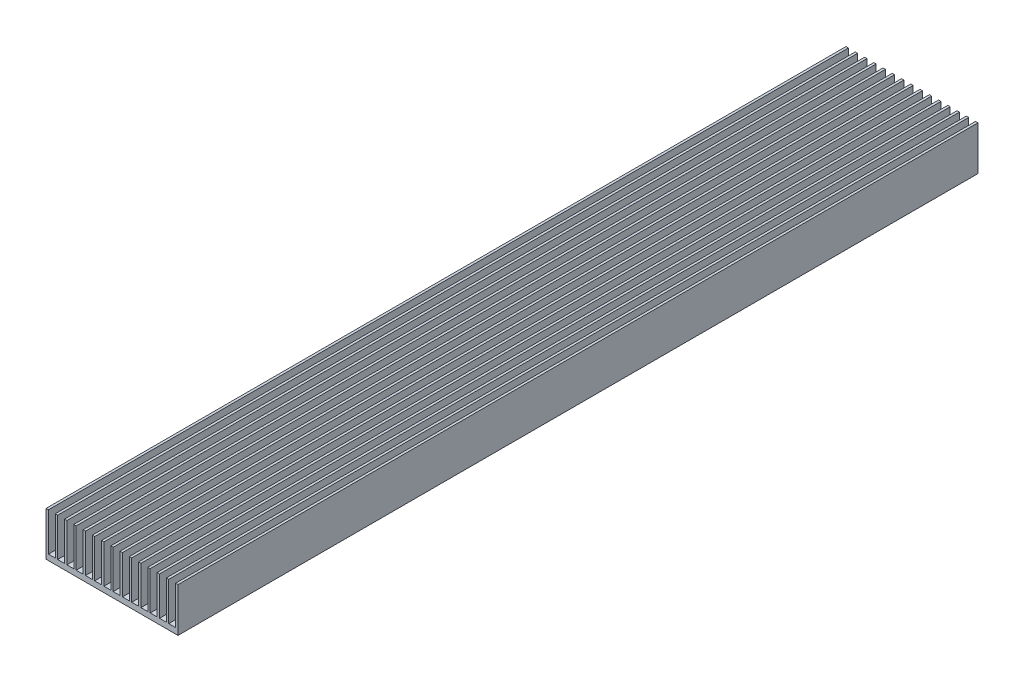
from build123d import *

# Parameters (mm, degrees)
BOSS_EXTRUDE1_DEPTH = 1000


with BuildPart() as part:
    # Sketch1 → Boss-Extrude1 (new body)
    with BuildSketch(Plane.XY):
        Polygon((11.571428571, 55), (11.571428571, 7), (3, 7), (3, 55), (0, 55), (0, 7), (0, 0), (165, 0), (165, 7), (165, 10), (165, 55), (162, 55), (162, 7), (153.428571429, 7), (153.428571429, 55), (150.428571429, 55), (150.428571429, 7), (141.857142857, 7), (141.857142857, 55), (138.857142857, 55), (138.857142857, 7), (130.285714286, 7), (130.285714286, 55), (127.285714286, 55), (127.285714286, 7), (118.714285714, 7), (118.714285714, 55), (115.714285714, 55), (115.714285714, 7), (107.142857143, 7), (107.142857143, 55), (104.142857143, 55), (104.142857143, 7), (95.571428571, 7), (95.571428571, 55), (92.571428571, 55), (92.571428571, 7), (84, 7), (84, 55), (81, 55), (81, 7), (72.428571429, 7), (72.428571429, 55), (69.428571429, 55), (69.428571429, 7), (60.857142857, 7), (60.857142857, 55), (57.857142857, 55), (57.857142857, 7), (49.285714286, 7), (49.285714286, 55), (46.285714286, 55), (46.285714286, 7), (37.714285714, 7), (37.714285714, 55), (34.714285714, 55), (34.714285714, 7), (26.142857143, 7), (26.142857143, 55), (23.142857143, 55), (23.142857143, 7), (14.571428571, 7), (14.571428571, 55), align=None)
    extrude(amount=BOSS_EXTRUDE1_DEPTH)


solid = part.part
